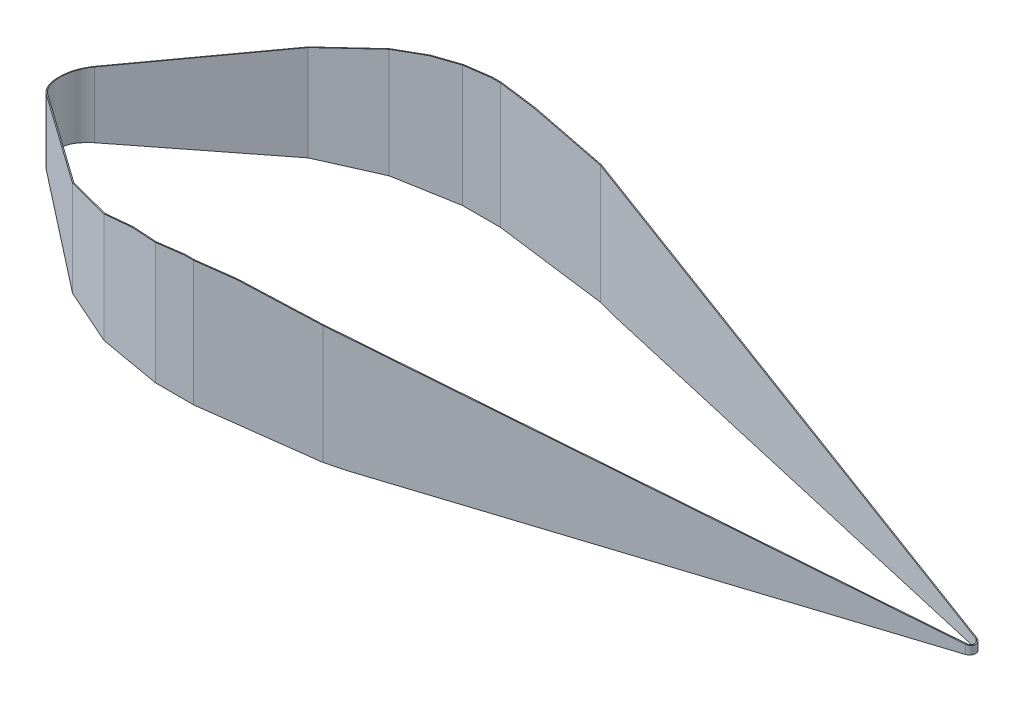
from build123d import *

# Parameters (mm, degrees)
TOPVIEW_EXTRUDE_DEPTH      = 800
SHELL1_T                   = -5
SIDEPROFILE_CUT_DEPTH      = 4992.748078174
SIDEPROFILE_CUT_DEPTH_BACK = 4992.748078174
SKETCH2_OUTSIDE_W          = 5781.309
SKETCH2_OUTSIDE_H          = 1819.37


with BuildPart() as part:
    # Sketch1 → TopView_Extrude (new body)
    with BuildSketch(Plane(origin=(0, 0, 0), x_dir=(1, 0, 0), z_dir=(0, 1, 0))):
        with BuildLine():
            Line((161.409759475, 126.088702216), (784.13, 612.54))
            Line((784.13, 612.54), (1076.464, 742.696))
            Line((1076.464, 742.696), (1401.451, 800))
            Line((1401.451, 800), (1600, 800))
            Line((1600, 800), (2195.064, 723.196))
            Line((2195.064, 723.196), (4839.463434647, 29.016863519))
            ThreePointArc((4839.463434647, 29.016863519), (4861.846241497, 0), (4839.463434647, -29.016863519))
            Line((4839.463434647, -29.016863519), (2195.064, -723.196))
            Line((2195.064, -723.196), (1600, -800))
            Line((1600, -800), (1401.451, -800))
            Line((1401.451, -800), (1076.464, -742.696))
            Line((1076.464, -742.696), (784.13, -612.54))
            Line((784.13, -612.54), (161.409759475, -126.088702216))
            ThreePointArc((161.409759475, -126.088702216), (99.906658784, 0), (161.409759475, 126.088702216))
        make_face()
    extrude(amount=TOPVIEW_EXTRUDE_DEPTH)

    # Shell1
    shell1_openings = [part.faces().sort_by_distance(p)[0] for p in [
        (2100.833726615, 0, 0),
        (2100.833726615, 800, 0),
    ]]
    offset(amount=SHELL1_T, openings=shell1_openings, kind=Kind.INTERSECTION)

    # Sketch2 outside → SideProfile_Cut (cut, two sides: drawn at the far end of the back side and taken through both)
    with BuildSketch(Plane.XY.offset(-SIDEPROFILE_CUT_DEPTH_BACK)):
        with Locations((2480.8765, 400)):
            Rectangle(SKETCH2_OUTSIDE_W, SKETCH2_OUTSIDE_H)
        with BuildLine():
            Line((0, 300), (0, 332.854109989))
            ThreePointArc((0, 332.854109989), (31.780435884, 425.180350356), (113.655128803, 478.384348558))
            Line((113.655128803, 478.384348558), (1255.921, 763.655))
            Line((1255.921, 763.655), (1551.451, 800))
            Line((1551.451, 800), (1800, 800))
            Line((1800, 800), (2197.056, 765.81))
            Line((2197.056, 765.81), (4950, 288.165))
            Line((4950, 288.165), (4950, 265.638))
            Line((4950, 265.638), (2301.451, 150))
            Line((2301.451, 150), (150, 150))
            ThreePointArc((150, 150), (43.933982822, 193.933982822), (0, 300))
        make_face(mode=Mode.SUBTRACT)
    extrude(amount=SIDEPROFILE_CUT_DEPTH + SIDEPROFILE_CUT_DEPTH_BACK, mode=Mode.SUBTRACT)


solid = part.part
